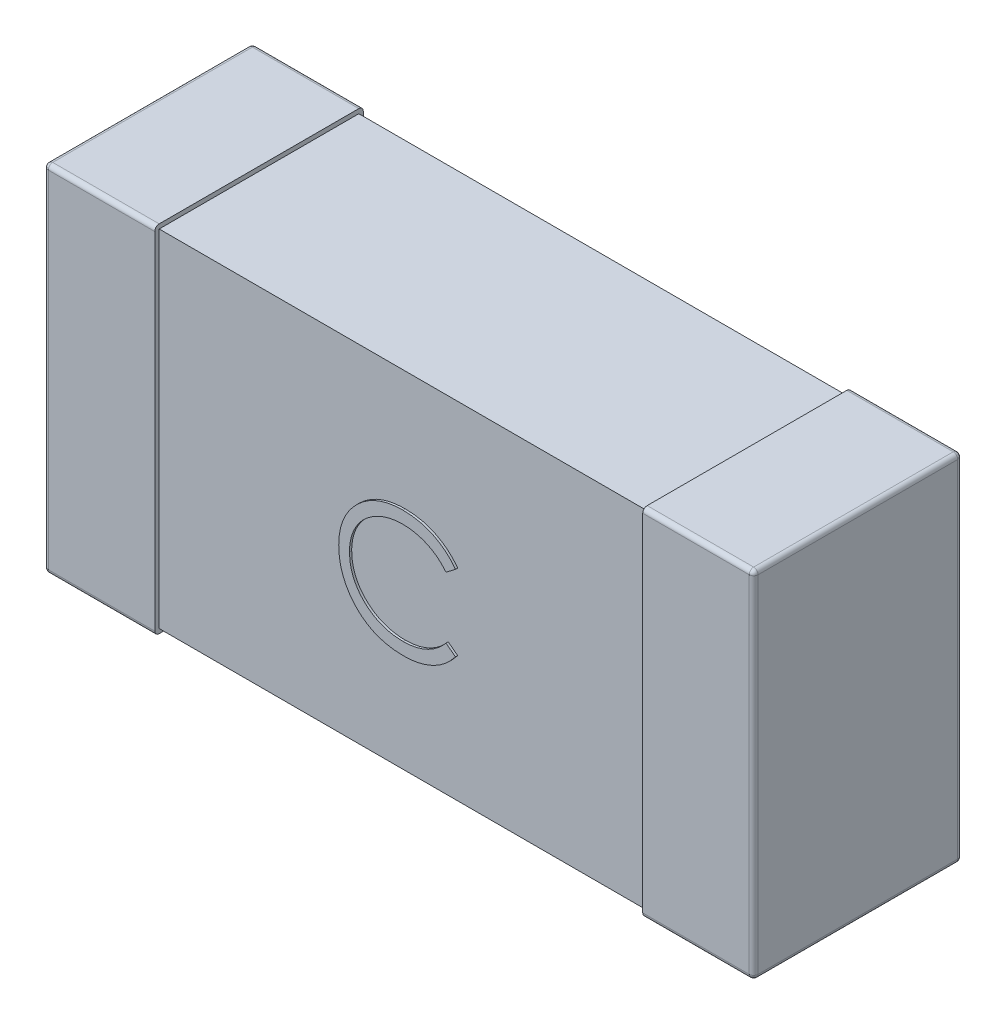
from build123d import *

# Parameters (mm, degrees)
EXTRUDE_1_DEPTH        = 0.92
EXTRUDE_1_DEPTH_BACK   = 0.02
SKETCH_3_W             = 0.5
SKETCH_3_H             = 1.6
EXTRUDE_1_2_DEPTH      = 0.92
EXTRUDE_1_2_DEPTH_BACK = 0.02
SKETCH_5_W             = 0.9
SKETCH_5_H             = 1.56
EXTRUDE_3_DEPTH        = 1.11
FILLET_3_R             = 0.02
EXTRUDE_4_DEPTH        = 0.01


with BuildPart() as part:
    # 草图3 → 凸台-拉伸1 (new, two sides: drawn at the far end of the back side and taken through both)
    with BuildSketch(Plane.XY.offset(-EXTRUDE_1_DEPTH_BACK)):
        with Locations((-1.35, 0)):
            Rectangle(SKETCH_3_W, SKETCH_3_H)
    extrude(amount=EXTRUDE_1_DEPTH + EXTRUDE_1_DEPTH_BACK)



with BuildPart() as body_2:
    # 草图3 → Extrude 1 2 (new, two sides: drawn at the far end of the back side and taken through both)
    with BuildSketch(Plane.XY.offset(-EXTRUDE_1_2_DEPTH_BACK)):
        with Locations((1.35, 0)):
            Rectangle(SKETCH_3_W, SKETCH_3_H)
    extrude(amount=EXTRUDE_1_2_DEPTH + EXTRUDE_1_2_DEPTH_BACK)


with BuildPart() as part_1:
    add(part.part)

    add(body_2.part)  # 凸台-拉伸3 merges body 2
    # 草图5 → 凸台-拉伸3 (add, symmetric)
    with BuildSketch(Plane(origin=(0, 0, 0), x_dir=(0, 0, -1), z_dir=(1, 0, 0))):
        with Locations((-0.45, 0)):
            Rectangle(SKETCH_5_W, SKETCH_5_H)
    extrude(amount=EXTRUDE_3_DEPTH, both=True)

    # 圆角3
    fillet_3_edges = [part_1.edges().sort_by_distance(p)[0] for p in [
        (-1.6, 0, -0.02),
        (-1.35, 0.8, 0.92),
        (-1.35, -0.8, -0.02),
        (-1.6, 0, 0.92),
        (-1.35, -0.8, 0.92),
        (1.6, 0.8, 0.45),
        (1.6, 0, -0.02),
        (1.6, -0.8, 0.45),
        (1.35, -0.8, -0.02),
        (1.35, 0.8, -0.02),
        (1.6, 0, 0.92),
        (1.35, 0.8, 0.92),
        (1.35, -0.8, 0.92),
        (-1.35, 0.8, -0.02),
        (-1.6, -0.8, 0.45),
        (-1.6, 0.8, 0.45),
    ]]
    fillet(fillet_3_edges, radius=FILLET_3_R)

    # 草图6 → 凸台-拉伸4 (add)
    with BuildSketch(Plane.XY.offset(0.9)):
        with BuildLine():
            Line((0.245585191, 0.128901731), (0.203181345, 0.096449807))
            add(Edge.make_bspline(
                [(0.203181345, 0.096449807), (0.200156436, 0.100054843), (0.194147402, 0.10721631), (0.184479982, 0.117272582), (0.174404871, 0.12669408), (0.163925921, 0.135525684), (0.152854514, 0.143458557), (0.141458848, 0.150906098), (0.129548292, 0.157581692), (0.113078025, 0.165675981), (0.091532357, 0.174122531), (0.064409724, 0.181204744), (0.036096583, 0.185713154), (0.016780382, 0.186201444), (0.006955383, 0.186449807)],
                knots=[0, 0, 0, 0, 0.757959112, 1.505699292, 2.245454638, 2.979532153, 3.711538275, 4.438200793, 5.171680507, 5.909471876, 7.393775596, 8.890124382, 10.418191784, 12, 12, 12, 12], degree=3))
            add(Edge.make_bspline(
                [(0.006955383, 0.186449807), (0.001542531, 0.186387482), (-0.009232936, 0.186263409), (-0.025224415, 0.184626573), (-0.040917286, 0.182325986), (-0.05630134, 0.178912365), (-0.071356997, 0.174596589), (-0.086182682, 0.169439525), (-0.100563746, 0.163059064), (-0.114699131, 0.156006933), (-0.128242209, 0.148041555), (-0.141056417, 0.13935321), (-0.153095018, 0.130039121), (-0.164367535, 0.120064378), (-0.174885493, 0.109473905), (-0.184572678, 0.098154835), (-0.19339557, 0.086143356), (-0.201529053, 0.073597859), (-0.208813304, 0.060554886), (-0.214912199, 0.046966161), (-0.22031299, 0.033064385), (-0.224586587, 0.018692491), (-0.227969227, 0.003951607), (-0.230303209, -0.011197828), (-0.23192143, -0.026724168), (-0.232044886, -0.03724789), (-0.232107117, -0.042552596)],
                knots=[0, 0, 0, 0, 1.054917814, 2.100044995, 3.131103042, 4.146048494, 5.169673617, 6.183595914, 7.203665975, 8.234915748, 9.262203917, 10.264457458, 11.251630812, 12.227803204, 13.197192746, 14.159520551, 15.12972552, 16.100847026, 17.073214652, 18.039054194, 19.002613845, 19.979014051, 20.95965708, 21.949030935, 22.966165397, 24, 24, 24, 24], degree=3))
            add(Edge.make_bspline(
                [(-0.232107117, -0.042552596), (-0.231912436, -0.050534), (-0.231530207, -0.066204427), (-0.228128464, -0.089157607), (-0.222959107, -0.111146511), (-0.215211561, -0.132033687), (-0.205658336, -0.152076691), (-0.193586927, -0.1709364), (-0.17960609, -0.188897812), (-0.163518036, -0.205536439), (-0.145866853, -0.220735699), (-0.126928604, -0.234120074), (-0.106750457, -0.245277228), (-0.085555205, -0.254561517), (-0.063179748, -0.261698269), (-0.039664321, -0.266722448), (-0.01506007, -0.269999813), (0.001752351, -0.270313582), (0.010308749, -0.270473269)],
                knots=[0, 0, 0, 0, 1.029171465, 2.020641659, 2.987623507, 3.938342917, 4.889210282, 5.84687017, 6.821220943, 7.821438502, 8.827599549, 9.822697543, 10.807740252, 11.797342354, 12.80366471, 13.83203677, 14.896651826, 16, 16, 16, 16], degree=3))
            add(Edge.make_bspline(
                [(0.010308749, -0.270473269), (0.019736021, -0.270212715), (0.038291147, -0.269699881), (0.065502214, -0.265355311), (0.091551161, -0.258310947), (0.116439388, -0.24845241), (0.140096734, -0.235636623), (0.162560218, -0.220100379), (0.183848804, -0.201695893), (0.196650087, -0.187643068), (0.203181345, -0.180473269)],
                knots=[0, 0, 0, 0, 1.028121516, 2.023589091, 2.998037872, 3.967518031, 4.937445131, 5.927275754, 6.942489185, 8, 8, 8, 8], degree=3))
            Line((0.203181345, -0.180473269), (0.245585191, -0.212600673))
            add(Edge.make_bspline(
                [(0.245585191, -0.212600673), (0.242172682, -0.217003749), (0.235364011, -0.225788809), (0.22433906, -0.238173587), (0.212724849, -0.249822781), (0.20043511, -0.260642471), (0.187611223, -0.27084916), (0.174022923, -0.280152871), (0.159848844, -0.288683465), (0.14513701, -0.296494476), (0.129903052, -0.303424566), (0.114165225, -0.309357433), (0.097991365, -0.31446813), (0.081380732, -0.318672715), (0.064298873, -0.321954539), (0.046807428, -0.324148432), (0.028868647, -0.32565147), (0.016766257, -0.325788463), (0.010633268, -0.325857885)],
                knots=[0, 0, 0, 0, 0.986787822, 1.968848986, 2.935600012, 3.899624008, 4.868462664, 5.837806735, 6.815139263, 7.798259679, 8.787526145, 9.778297419, 10.776456485, 11.791383307, 12.812564526, 13.85620153, 14.913611965, 16, 16, 16, 16], degree=3))
            add(Edge.make_bspline(
                [(0.010633268, -0.325857885), (0.004825388, -0.325817463), (-0.006658976, -0.325737534), (-0.023614783, -0.324442743), (-0.040121747, -0.322676212), (-0.056132689, -0.320016306), (-0.071734983, -0.316877465), (-0.086787187, -0.3126699), (-0.10143742, -0.3079566), (-0.115626821, -0.302416973), (-0.12936746, -0.296165905), (-0.14261502, -0.289100921), (-0.155363406, -0.281281434), (-0.167737957, -0.272879804), (-0.17955587, -0.263626163), (-0.190919557, -0.253649025), (-0.201892739, -0.242982017), (-0.208681724, -0.235290126), (-0.212095098, -0.231422789)],
                knots=[0, 0, 0, 0, 1.114604814, 2.203992996, 3.262667896, 4.300477797, 5.318619304, 6.316056647, 7.298880507, 8.271930387, 9.238335007, 10.195173496, 11.151986948, 12.108099108, 13.064862484, 14.031167946, 15.010108607, 16, 16, 16, 16], degree=3))
            add(Edge.make_bspline(
                [(-0.212095098, -0.231422789), (-0.217562311, -0.224705005), (-0.228430733, -0.211350541), (-0.242335839, -0.189706419), (-0.254238604, -0.167108466), (-0.263862318, -0.143437963), (-0.271385711, -0.118748023), (-0.276597667, -0.093026201), (-0.279984486, -0.066296519), (-0.280371788, -0.048115985), (-0.280568655, -0.038874712)],
                knots=[0, 0, 0, 0, 0.994628077, 1.977248131, 2.950237994, 3.925870899, 4.908910175, 5.911660606, 6.938484602, 8, 8, 8, 8], degree=3))
            add(Edge.make_bspline(
                [(-0.280568655, -0.038874712), (-0.280328711, -0.029161585), (-0.279856636, -0.010051613), (-0.275845856, 0.017993511), (-0.269393813, 0.044862584), (-0.260229722, 0.070505447), (-0.248611182, 0.095056976), (-0.234258504, 0.118329619), (-0.217338431, 0.140472211), (-0.197983664, 0.161148773), (-0.176758989, 0.180054844), (-0.1540298, 0.196687801), (-0.129840586, 0.210529933), (-0.104457832, 0.222100769), (-0.077691469, 0.230994486), (-0.049598607, 0.237220406), (-0.020232031, 0.241095619), (-0.000196114, 0.241585508), (0.009984229, 0.241834423)],
                knots=[0, 0, 0, 0, 1.032925535, 2.032216505, 3.007276963, 3.968222605, 4.92396291, 5.891752235, 6.871517503, 7.883894988, 8.900124299, 9.891468569, 10.874487609, 11.85992873, 12.854644235, 13.869047385, 14.917252991, 16, 16, 16, 16], degree=3))
            add(Edge.make_bspline(
                [(0.009984229, 0.241834423), (0.016188748, 0.241760036), (0.028469967, 0.241612794), (0.046637519, 0.240176989), (0.064325193, 0.237783462), (0.081545173, 0.234525554), (0.098381234, 0.230482138), (0.114704699, 0.225214778), (0.130611354, 0.219191999), (0.146000877, 0.21225555), (0.16079943, 0.204469253), (0.175002405, 0.195919414), (0.188496983, 0.186616632), (0.20137812, 0.176640028), (0.213430335, 0.165778536), (0.224995821, 0.154330907), (0.235681816, 0.141967403), (0.242278023, 0.133264927), (0.245585191, 0.128901731)],
                knots=[0, 0, 0, 0, 1.096760587, 2.17092713, 3.219439832, 4.250915756, 5.268269357, 6.278326846, 7.281116186, 8.274029601, 9.260640565, 10.235837813, 11.203064059, 12.156899882, 13.114053108, 14.069676657, 15.032185724, 16, 16, 16, 16], degree=3))
        make_face()
    extrude(amount=EXTRUDE_4_DEPTH)


solid = part_1.part
